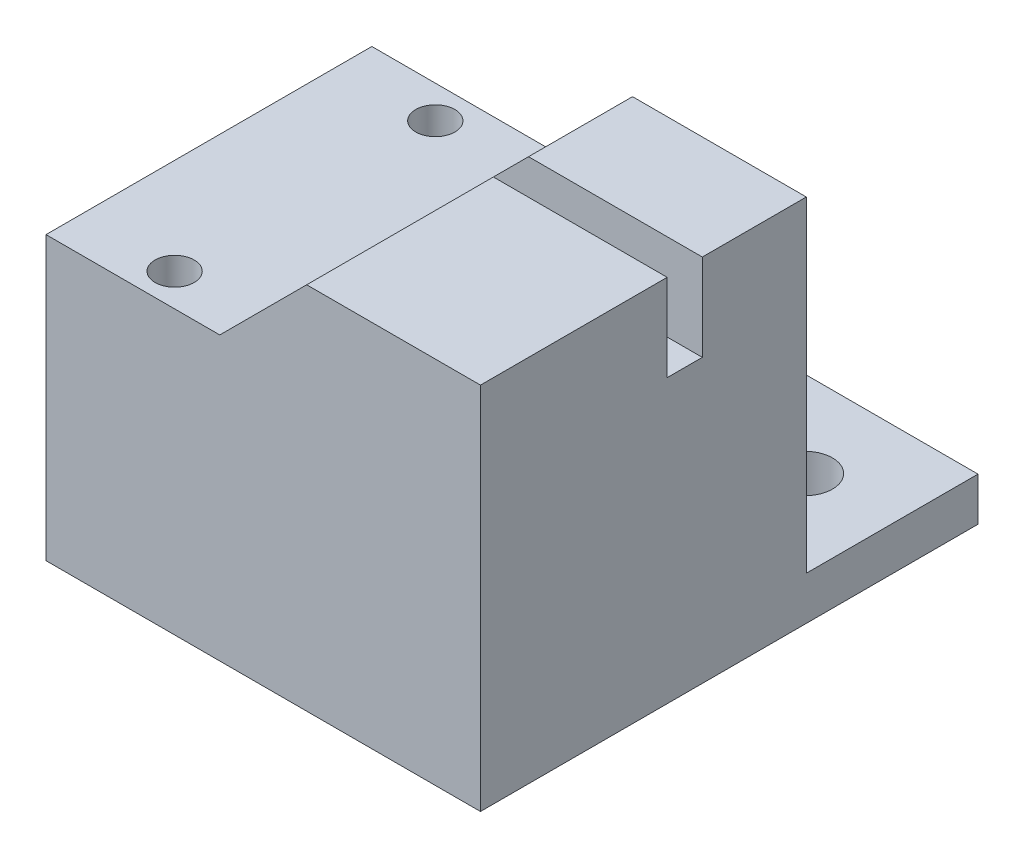
from build123d import *

# Parameters (mm, degrees)
SKETCH_1_W               = 200
SKETCH_1_H               = 150
EXTRUDE_1_DEPTH          = 180
CUT_EXTRUDE_1_DEPTH      = 100
SKETCH_3_W               = 120
SKETCH_3_H               = 16.18209701
CUT_EXTRUDE_2_DEPTH      = 50
SKETCH_4_R               = 9
CUT_EXTRUDE_3_DEPTH      = 20
SKETCH_5_W               = 79.036616744
SKETCH_5_H               = 20
EXTRUDE_2_DEPTH          = 200
SKETCH_6_R               = 12.5
CUT_EXTRUDE_4_DEPTH      = 210
CUT_EXTRUDE_5_DEPTH      = 308.989889135
CUT_EXTRUDE_5_DEPTH_BACK = 308.989889135


with BuildPart() as part:
    # 草图1 → 凸台-拉伸1 (new body)
    with BuildSketch(Plane(origin=(0, 0, 0), x_dir=(1, 0, 0), z_dir=(0, 1, 0))):
        Rectangle(SKETCH_1_W, SKETCH_1_H)
    extrude(amount=EXTRUDE_1_DEPTH)

    # 草图2 → 切除-拉伸1 (cut, symmetric)
    with BuildSketch(Plane.XY):
        Polygon((-100, 180), (30, 180), (-20, 130), (-100, 130), align=None)
    extrude(amount=CUT_EXTRUDE_1_DEPTH, both=True, mode=Mode.SUBTRACT)

    # 草图3 → 切除-拉伸2 (cut)
    with BuildSketch(Plane(origin=(0, 180, 0), x_dir=(1, 0, 0), z_dir=(0, 1, 0))):
        with Locations((40, 19.036616744)):
            Rectangle(SKETCH_3_W, SKETCH_3_H)
    extrude(amount=-CUT_EXTRUDE_2_DEPTH, mode=Mode.SUBTRACT)

    # 草图4 → 切除-拉伸3 (cut)
    with BuildSketch(Plane(origin=(0, 130, 0), x_dir=(1, 0, 0), z_dir=(0, 1, 0))):
        with Locations(Location((-55.786910577, 60, 0), (0, 0, 180))):
            Circle(SKETCH_4_R)
        with Locations(Location((-55.786910577, -60, 0), (0, 0, 180))):
            Circle(SKETCH_4_R)
    extrude(amount=-CUT_EXTRUDE_3_DEPTH, mode=Mode.SUBTRACT)

    # 草图5 → 凸台-拉伸2 (add)
    with BuildSketch(Plane(origin=(100, 0, 0), x_dir=(0, 0, -1), z_dir=(1, 0, 0))):
        with Locations((114.518308372, 10)):
            Rectangle(SKETCH_5_W, SKETCH_5_H)
    extrude(amount=-EXTRUDE_2_DEPTH)

    # 草图6 → 切除-拉伸4 (cut)
    with BuildSketch(Plane(origin=(0, 20, 0), x_dir=(1, 0, 0), z_dir=(0, 1, 0))):
        with Locations(Location((-60, 114.518308372, 0), (0, 0, 270))):
            Circle(SKETCH_6_R)
        with Locations(Location((60, 114.518308372, 0), (0, 0, 270))):
            Circle(SKETCH_6_R)
    extrude(amount=-CUT_EXTRUDE_4_DEPTH, mode=Mode.SUBTRACT)

    # 草图7 → 切除-拉伸5 (cut, two sides: drawn at the far end of the back side and taken through both)
    with BuildSketch(Plane.XY.offset(75).offset(-CUT_EXTRUDE_5_DEPTH_BACK)):
        Polygon((20, 170), (112.388945941, 170), (112.388945941, 195.821739968), (6.51381217, 195.821739968), align=None)
    extrude(amount=CUT_EXTRUDE_5_DEPTH + CUT_EXTRUDE_5_DEPTH_BACK, mode=Mode.SUBTRACT)


solid = part.part
